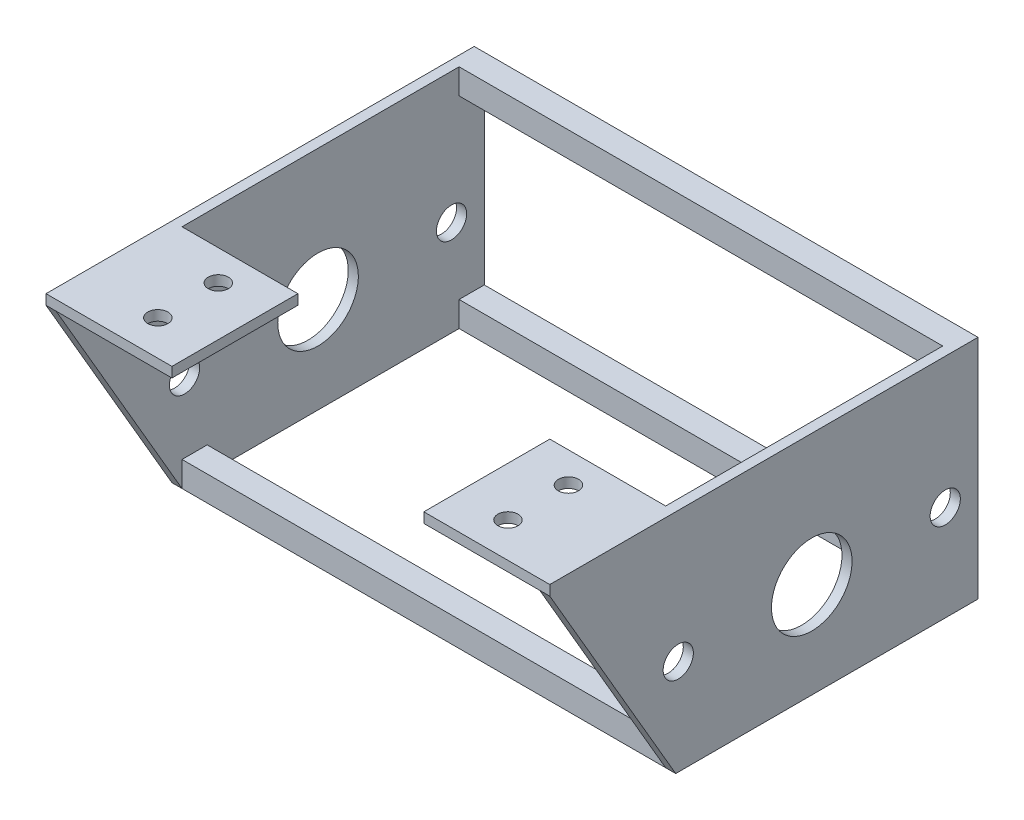
from build123d import *

# Parameters (mm, degrees)
SKETCH1_W               = 100
SKETCH1_H               = 45
BOSS_EXTRUDE1_DEPTH     = 90
CUT_EXTRUDE1_DEPTH      = 137.404728657
CUT_EXTRUDE2_DEPTH      = 109.397416943
CUT_EXTRUDE2_DEPTH_BACK = 109.397416943
SKETCH3_W               = 96
SKETCH3_H               = 32.638698082
SKETCH4_W               = 96
SKETCH4_H               = 35
CUT_EXTRUDE4_DEPTH      = 102.149641621
SKETCH5_R               = 8
SKETCH5_R_2             = 3
CUT_EXTRUDE5_DEPTH      = 134.158739856
SKETCH7_W               = 96
SKETCH7_H               = 3
CUT_EXTRUDE7_DEPTH      = 73.452349302
SKETCH9_W               = 50
SKETCH9_H               = 59.094844588
CUT_EXTRUDE9_DEPTH      = 34
SKETCH10_R              = 2
CUT_EXTRUDE10_DEPTH     = 34
CUT_EXTRUDE11_DEPTH     = 109.397416943
SKETCH11_W              = 96
SKETCH11_H              = 6.475085822
CUT_EXTRUDE12_DEPTH     = 34
SKETCH12_W              = 23
SKETCH12_H              = 26.924334535
CUT_EXTRUDE13_DEPTH     = 34


with BuildPart() as part:
    # Sketch1 → Boss-Extrude1 (new body)
    with BuildSketch(Plane.XY):
        Rectangle(SKETCH1_W, SKETCH1_H)
    extrude(amount=BOSS_EXTRUDE1_DEPTH)

    # Sketch2 → Cut-Extrude1 (cut, through all)
    with BuildSketch(Plane.ZY.offset(50)):
        Polygon((60, -22.5), (85, 20.5), (85, 22.5), (90, 22.5), (90, -22.5), align=None)
    extrude(amount=-CUT_EXTRUDE1_DEPTH, mode=Mode.SUBTRACT)

    # Sketch3 → Cut-Extrude2 (cut, two sides: drawn at the far end of the back side and taken through both)
    with BuildSketch(Plane(origin=(0, 22.5, 0), x_dir=(1, 0, 0), z_dir=(0, 1, 0)).offset(-CUT_EXTRUDE2_DEPTH_BACK)):
        with Locations((0, -21.319349041)):
            Rectangle(SKETCH3_W, SKETCH3_H)
    extrude(amount=CUT_EXTRUDE2_DEPTH + CUT_EXTRUDE2_DEPTH_BACK, mode=Mode.SUBTRACT)

    # Sketch4 → Cut-Extrude4 (cut, through all)
    with BuildSketch(Plane(origin=(0, 0, 0), x_dir=(-1, 0, 0), z_dir=(0, 0, -1))):
        Rectangle(SKETCH4_W, SKETCH4_H)
    extrude(amount=-CUT_EXTRUDE4_DEPTH, mode=Mode.SUBTRACT)

    # Sketch5 → Cut-Extrude5 (cut, through all)
    with BuildSketch(Plane(origin=(50, 0, 0), x_dir=(0, 0, -1), z_dir=(1, 0, 0))):
        with Locations(Location((-33, -3.5, 0), (0, 0, 90))):
            Circle(SKETCH5_R)
        with Locations(Location((-6.5, -3.5, 0), (0, 0, 90))):
            Circle(SKETCH5_R_2)
        with Locations(Location((-59.5, -3.5, 0), (0, 0, 90))):
            Circle(SKETCH5_R_2)
    extrude(amount=-CUT_EXTRUDE5_DEPTH, mode=Mode.SUBTRACT)

    # Sketch7 → Cut-Extrude7 (cut, through all)
    with BuildSketch(Plane(origin=(0, 0, 37.638698082), x_dir=(-1, 0, 0), z_dir=(0, 0, -1))):
        with Locations((0, 19)):
            Rectangle(SKETCH7_W, SKETCH7_H)
    extrude(amount=-CUT_EXTRUDE7_DEPTH, mode=Mode.SUBTRACT)

    # Sketch9 → Cut-Extrude9 (cut)
    with BuildSketch(Plane.XZ.offset(-20.5)):
        with Locations((0, 59.291541431)):
            Rectangle(SKETCH9_W, SKETCH9_H)
    extrude(amount=-CUT_EXTRUDE9_DEPTH, mode=Mode.SUBTRACT)

    # Sketch10 → Cut-Extrude10 (cut)
    with BuildSketch(Plane.XZ.offset(-20.5)):
        with Locations(Location((34.75, 78.05, 0), (0, 0, 270))):
            Circle(SKETCH10_R)
        with Locations(Location((34.75, 66.05, 0), (0, 0, 270))):
            Circle(SKETCH10_R)
        with Locations(Location((-34.75, 66.05, 0), (0, 0, 270))):
            Circle(SKETCH10_R)
        with Locations(Location((-34.75, 78.05, 0), (0, 0, 270))):
            Circle(SKETCH10_R)
    extrude(amount=-CUT_EXTRUDE10_DEPTH, mode=Mode.SUBTRACT)

    # Sketch8 → Cut-Extrude11 (cut, through all)
    with BuildSketch(Plane.XZ.offset(22.5)):
        Polygon((-48, 51.874077108), (-48, 37.638698082), (48, 37.638698082), (48, 51.874077108), (48, 55), (-48, 55), align=None)
    extrude(amount=-CUT_EXTRUDE11_DEPTH, mode=Mode.SUBTRACT)

    # Sketch11 → Cut-Extrude12 (cut)
    with BuildSketch(Plane.XZ.offset(22.5)):
        with Locations((0, 63.237542911)):
            Rectangle(SKETCH11_W, SKETCH11_H)
    extrude(amount=-CUT_EXTRUDE12_DEPTH, mode=Mode.SUBTRACT)

    # Sketch12 → Cut-Extrude13 (cut)
    with BuildSketch(Plane.XZ.offset(-20.5)):
        with Locations((-36.5, 46.537832733)):
            Rectangle(SKETCH12_W, SKETCH12_H)
        with Locations((36.5, 46.537832733)):
            Rectangle(SKETCH12_W, SKETCH12_H)
    extrude(amount=-CUT_EXTRUDE13_DEPTH, mode=Mode.SUBTRACT)


solid = part.part
